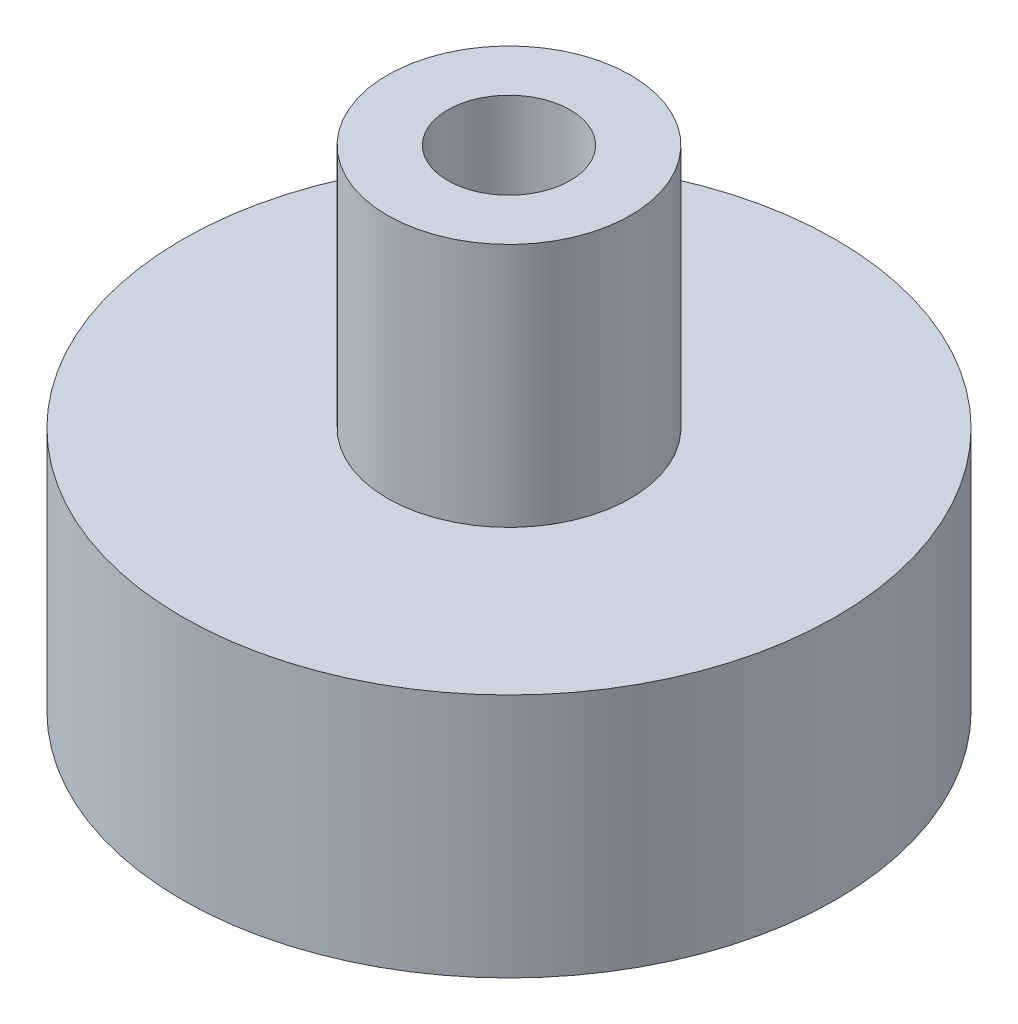
from build123d import *

# Parameters (mm, degrees)
SKETCH1_R           = 6.35
SKETCH1_R_2         = 1.190625
BOSS_EXTRUDE1_DEPTH = 4.7625
SKETCH4_R           = 2.3622
SKETCH4_R_2         = 1.190625
BOSS_EXTRUDE2_DEPTH = 9.525


with BuildPart() as part:
    # Sketch1 → Boss-Extrude1 (new body)
    with BuildSketch(Plane(origin=(0, 0, 0), x_dir=(1, 0, 0), z_dir=(0, 1, 0))):
        with Locations(Location((-27.91812688, -5.991014352, 0), (0, 0, 90))):
            Circle(SKETCH1_R)
        with Locations(Location((-27.91812688, -5.991014352, 0), (0, 0, 90))):
            Circle(SKETCH1_R_2, mode=Mode.SUBTRACT)
    extrude(amount=BOSS_EXTRUDE1_DEPTH)

    # Sketch4 → Boss-Extrude2 (add)
    with BuildSketch(Plane(origin=(0, 0, 0), x_dir=(1, 0, 0), z_dir=(0, 1, 0))):
        with Locations(Location((-27.91812688, -5.991014352, 0), (0, 0, 270))):
            Circle(SKETCH4_R)
        with Locations(Location((-27.91812688, -5.991014352, 0), (0, 0, 90))):
            Circle(SKETCH4_R_2, mode=Mode.SUBTRACT)
    extrude(amount=BOSS_EXTRUDE2_DEPTH)


solid = part.part
